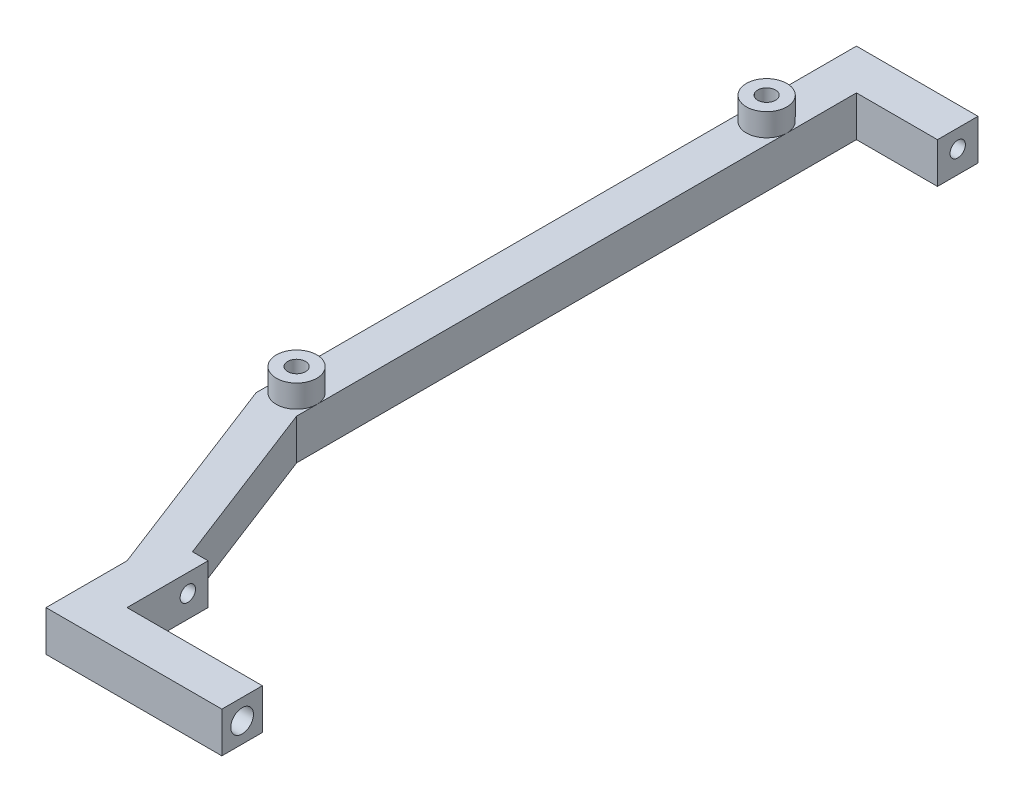
from build123d import *

# Parameters (mm, degrees)
SKETCH1_W           = 5
SKETCH1_H           = 5
BOSS_EXTRUDE1_DEPTH = 74.08
SKETCH2_R           = 1.4
CUT_EXTRUDE1_DEPTH  = 10
SKETCH3_W           = 5
SKETCH3_H           = 5
BOSS_EXTRUDE2_DEPTH = 10
SKETCH4_R           = 0.95
CUT_EXTRUDE2_DEPTH  = 5
SKETCH5_R           = 2.5
SKETCH5_R_2         = 1.1
BOSS_EXTRUDE3_DEPTH = 2.8
SKETCH6_W           = 5
SKETCH6_H           = 5
SKETCH6_R           = 0.95
BOSS_EXTRUDE4_DEPTH = 5
BOSS_EXTRUDE5_DEPTH = 5
BOSS_EXTRUDE6_START = 2.5
BOSS_EXTRUDE6_DEPTH = 5
SKETCH9_R           = 1.4
CUT_EXTRUDE3_DEPTH  = 10


with BuildPart() as part:
    # Sketch1 → Boss-Extrude1 (new body)
    with BuildSketch(Plane.XY):
        Rectangle(SKETCH1_W, SKETCH1_H)
    extrude(amount=BOSS_EXTRUDE1_DEPTH)

    # Sketch2 → Cut-Extrude1 (cut)
    with BuildSketch(Plane(origin=(0, 0, 0), x_dir=(-1, 0, 0), z_dir=(0, 0, -1))):
        Circle(SKETCH2_R)
    extrude(amount=-CUT_EXTRUDE1_DEPTH, mode=Mode.SUBTRACT)

    # Sketch3 → Boss-Extrude2 (add)
    with BuildSketch(Plane(origin=(2.5, 0, 0), x_dir=(0, 0, -1), z_dir=(1, 0, 0))):
        with Locations((-2.5, 0)):
            Rectangle(SKETCH3_W, SKETCH3_H)
    extrude(amount=BOSS_EXTRUDE2_DEPTH)

    # Sketch4 → Cut-Extrude2 (cut)
    with BuildSketch(Plane(origin=(12.5, 0, 0), x_dir=(0, 0, -1), z_dir=(1, 0, 0))):
        with Locations(Location((-2.5, 0.25, 0), (0, 0, 90))):
            Circle(SKETCH4_R)
    extrude(amount=-CUT_EXTRUDE2_DEPTH, mode=Mode.SUBTRACT)

    # Sketch5 → Boss-Extrude3 (add)
    # profile 1 of 2: a face of its own
    with BuildSketch(Plane(origin=(0, 2.5, 0), x_dir=(1, 0, 0), z_dir=(0, 1, 0))):
        with Locations(Location((0, -13.58, 0), (0, 0, 180))):
            Circle(SKETCH5_R)
        with Locations(Location((0, -13.58, 0), (0, 0, 270))):
            Circle(SKETCH5_R_2, mode=Mode.SUBTRACT)
    # profile 2 of 2: a face of its own
    with BuildSketch(Plane(origin=(0, 2.5, 0), x_dir=(1, 0, 0), z_dir=(0, 1, 0))):
        with Locations(Location((0, -71.58, 0), (0, 0, 270))):
            Circle(SKETCH5_R)
        with Locations(Location((0, -71.58, 0), (0, 0, 270))):
            Circle(SKETCH5_R_2, mode=Mode.SUBTRACT)
    extrude(amount=BOSS_EXTRUDE3_DEPTH)



with BuildPart() as body_2:
    # Sketch6 → Boss-Extrude4 (new body)
    with BuildSketch(Plane(origin=(12.5, 0, 0), x_dir=(0, 0, -1), z_dir=(1, 0, 0))):
        with Locations((-97.5, 0)):
            Rectangle(SKETCH6_W, SKETCH6_H)
        with Locations(Location((-97.5, 0.25, 0), (0, 0, 90))):
            Circle(SKETCH6_R, mode=Mode.SUBTRACT)
    extrude(amount=-BOSS_EXTRUDE4_DEPTH)


with BuildPart() as part_1:
    add(part.part)

    add(body_2.part)  # Boss-Extrude5 merges body 2
    # Sketch7 → Boss-Extrude5 (add)
    with BuildSketch(Plane(origin=(0, 2.5, 0), x_dir=(1, 0, 0), z_dir=(0, 1, 0))):
        Polygon((7.5, -100), (-2.5, -74.08), (2.5, -74.08), (10.570987654, -95), (7.5, -95), align=None)
    extrude(amount=-BOSS_EXTRUDE5_DEPTH)

    # Sketch8 → Boss-Extrude6 (add)
    with BuildSketch(Plane(origin=(0, 0, 0), x_dir=(1, 0, 0), z_dir=(0, 1, 0)).offset(BOSS_EXTRUDE6_START)):
        Polygon((7.5, -100), (7.5, -110), (29.2, -110), (29.2, -105), (12.5, -105), (12.5, -100), align=None)
    extrude(amount=-BOSS_EXTRUDE6_DEPTH)

    # Sketch9 → Cut-Extrude3 (cut)
    with BuildSketch(Plane(origin=(29.2, 0, 0), x_dir=(0, 0, -1), z_dir=(1, 0, 0))):
        with Locations((-107.5, 0)):
            Circle(SKETCH9_R)
    extrude(amount=-CUT_EXTRUDE3_DEPTH, mode=Mode.SUBTRACT)


solid = part_1.part
